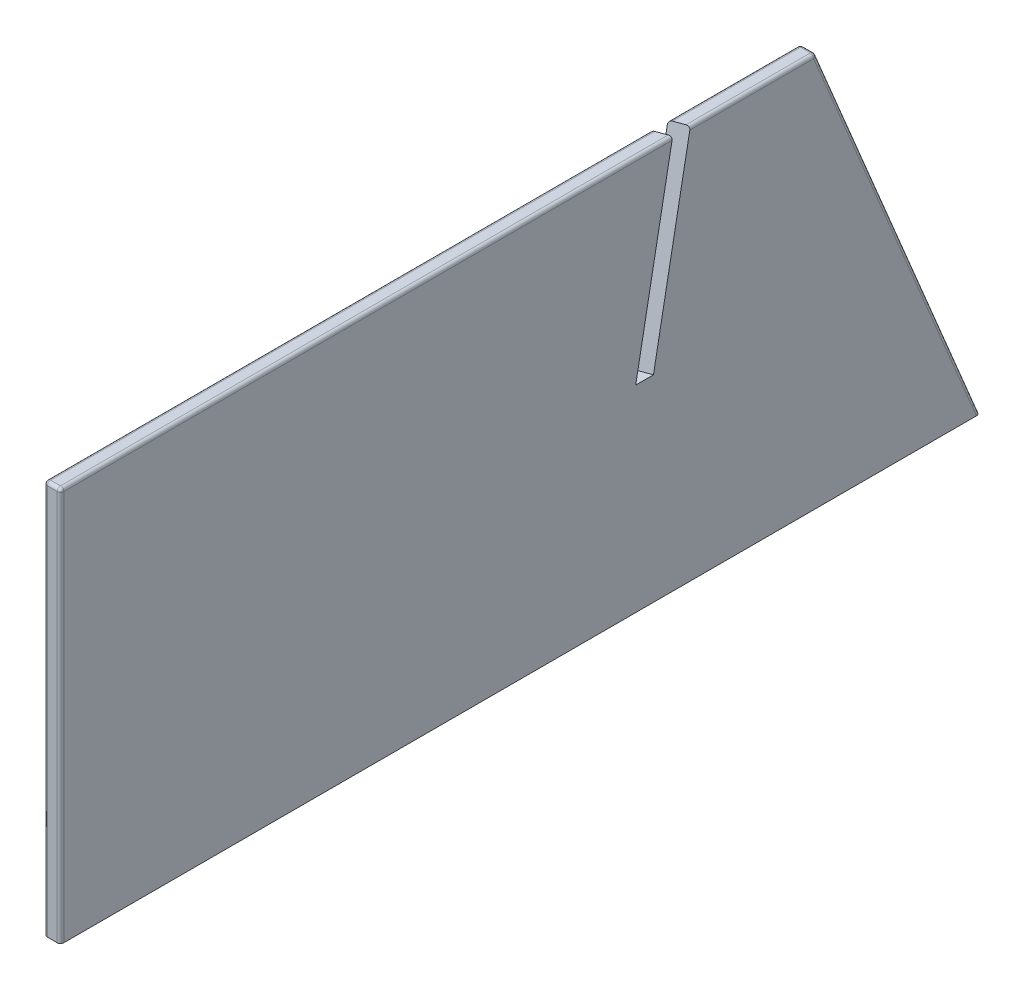
from build123d import *

# Parameters (mm, degrees)
BOSS_EXTRUDE2_DEPTH = 12.7
CUT_EXTRUDE1_DEPTH  = 774.866765018
FILLET1_R           = 2.54


with BuildPart() as part:
    # Sketch1 → Boss-Extrude2 (new body)
    with BuildSketch(Plane(origin=(0, 0, 0), x_dir=(0, 0, -1), z_dir=(1, 0, 0))):
        Polygon((584.2, 304.8), (0, 304.8), (0, 0), (711.2, 0), align=None)
    extrude(amount=BOSS_EXTRUDE2_DEPTH)

    # Sketch3 → Cut-Extrude1 (cut, through all)
    with BuildSketch(Plane(origin=(0, 0, 0), x_dir=(0, 1, 0), z_dir=(0.9396926207859083, 0, -0.34202014332566943))):
        Polygon((304.8, -453.495658666), (152.4, -426.623426806), (152.4, -413.727508835), (304.8, -440.599740695), align=None)
    extrude(amount=CUT_EXTRUDE1_DEPTH, mode=Mode.SUBTRACT)

    # Fillet1
    fillet1_edges = [part.edges().sort_by_distance(p)[0] for p in [
        (12.7, 152.4, 0),
        (0, 152.4, 0),
        (6.35, 304.8, 0),
        (0, 304.8, -234.438225303),
        (12.7, 304.8, -236.749436291),
        (12.7, 152.4, -647.7),
        (6.35, 304.8, -584.2),
        (0, 152.4, -647.7),
        (12.7, 304.8, -535.711210921),
        (0, 304.8, -533.399999933),
    ]]
    fillet(fillet1_edges, radius=FILLET1_R)


solid = part.part
